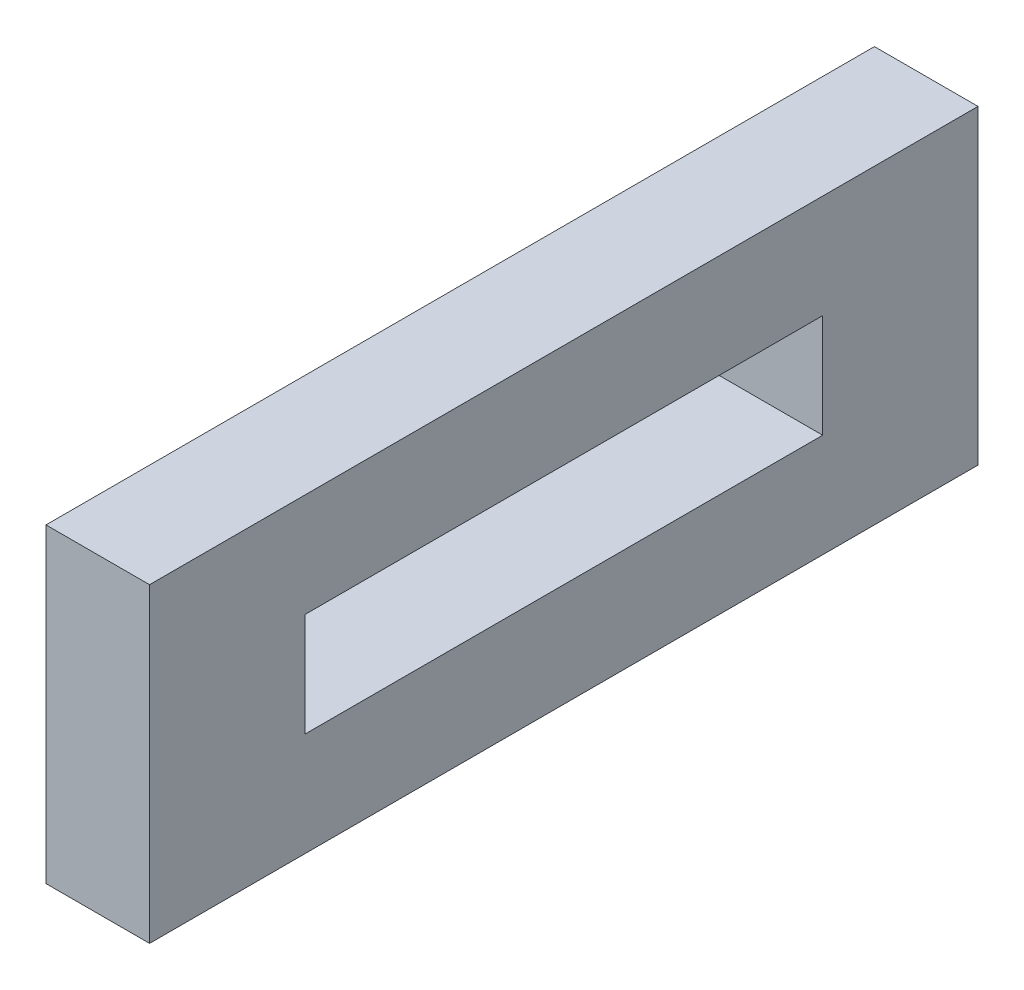
from build123d import *

# Parameters (mm, degrees)
SKETCH2_W           = 80
SKETCH2_H           = 30
SKETCH2_W_2         = 50
SKETCH2_H_2         = 10
BOSS_EXTRUDE1_DEPTH = 10


with BuildPart() as part:
    # Sketch2 → Boss-Extrude1 (new body)
    with BuildSketch(Plane(origin=(0, 0, 0), x_dir=(0, 0, -1), z_dir=(1, 0, 0))):
        Rectangle(SKETCH2_W, SKETCH2_H)
        Rectangle(SKETCH2_W_2, SKETCH2_H_2, mode=Mode.SUBTRACT)
    extrude(amount=BOSS_EXTRUDE1_DEPTH)


solid = part.part
